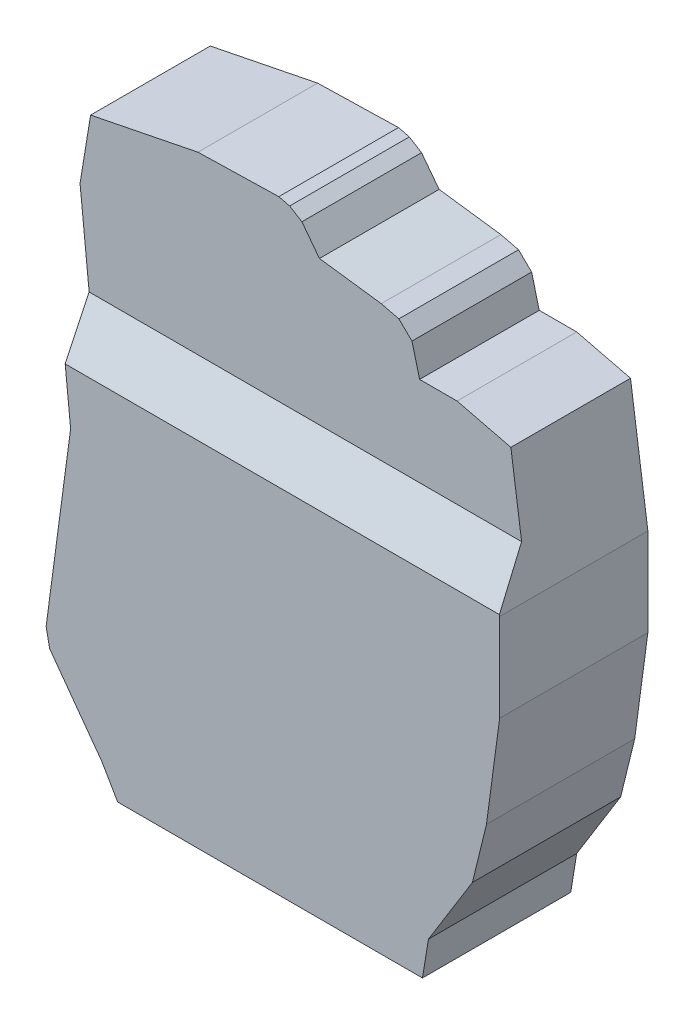
from build123d import *

# Parameters (mm, degrees)
BOSS_EXTRUDE1_DEPTH     = 30
CUT_EXTRUDE2_DEPTH      = 161.362841695
CUT_EXTRUDE2_DEPTH_BACK = 161.362841695


with BuildPart() as part:
    # Sketch1 → Boss-Extrude1 (new body)
    with BuildSketch(Plane.XY):
        Polygon((546.580924534, 9.896085679), (608.250924534, 9.896085679), (609.468725462, 17.325239217), (618.364062826, 31.698748766), (621.209508482, 43.308723045), (623.868380606, 63.224196603), (623.868380606, 81.054488799), (620.357339754, 106.059490311), (609.468725462, 108.728140515), (601.88762533, 108.728140515), (600.342350418, 114.668879106), (597.693307712, 117.244337292), (594.121848564, 118.119653006), (581.623216062, 119.788318601), (578.065152196, 124.442825109), (575.59297034, 125.972784898), (573.39799577, 126.510743097), (557.030037078, 126.118131563), (535.309704018, 121.76025213), (533.883150006, 113.057607434), (533.173455584, 108.728140515), (536.320171406, 77.786869686), (537.054893461, 70.562437811), (532.098682684, 33.439447285), (532.810591456, 29.891185826), (543.388975695, 15.373727724), align=None)
    extrude(amount=BOSS_EXTRUDE1_DEPTH)

    # Sketch2 → Cut-Extrude2 (cut, two sides: drawn at the far end of the back side and taken through both)
    with BuildSketch(Plane(origin=(530, 0, 0), x_dir=(0, 0, -1), z_dir=(1, 0, 0)).offset(-CUT_EXTRUDE2_DEPTH_BACK)):
        Polygon((-24.212, 126.510743097), (-24.212, 90.610743097), (-30, 81.373139386), (-30, 126.510743097), align=None)
    extrude(amount=CUT_EXTRUDE2_DEPTH + CUT_EXTRUDE2_DEPTH_BACK, mode=Mode.SUBTRACT)


solid = part.part
